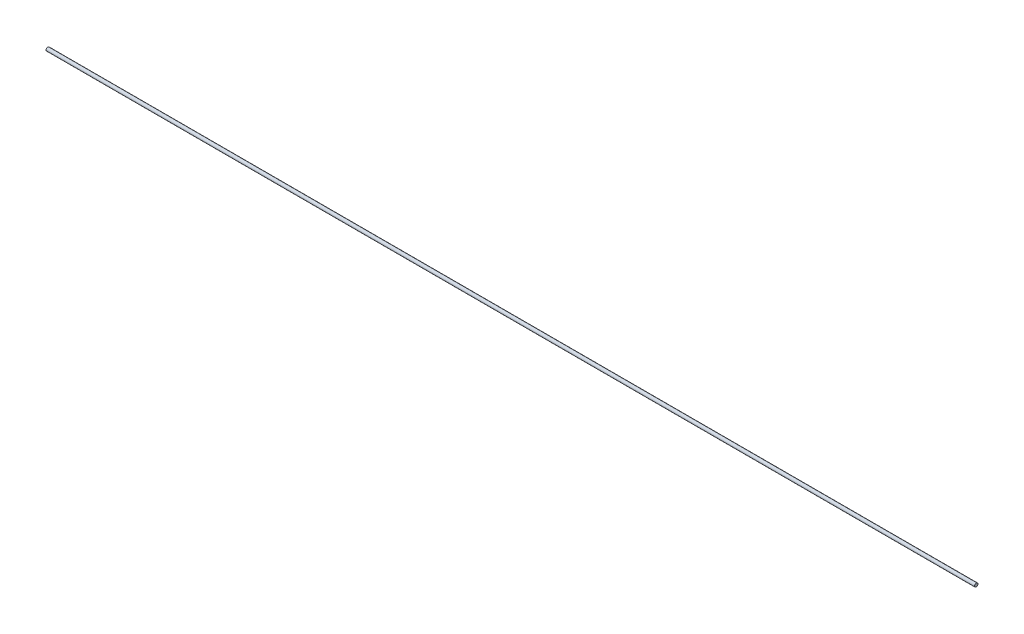
from build123d import *

# Parameters (mm, degrees)
SKETCH1_W = 1711.217611328
SKETCH1_H = 3.175


with BuildPart() as part:
    # Sketch1 → Revolve1 (revolve)
    with BuildSketch(Plane.XY, mode=Mode.PRIVATE) as revolve1_sk:
        with Locations((855.608805664, 1.5875)):
            Rectangle(SKETCH1_W, SKETCH1_H)
    revolve(revolve1_sk.sketch.rotate(Axis((0, 0, 0), (1, 0, 0)), 90), axis=Axis((0, 0, 0), (1, 0, 0)))


solid = part.part
